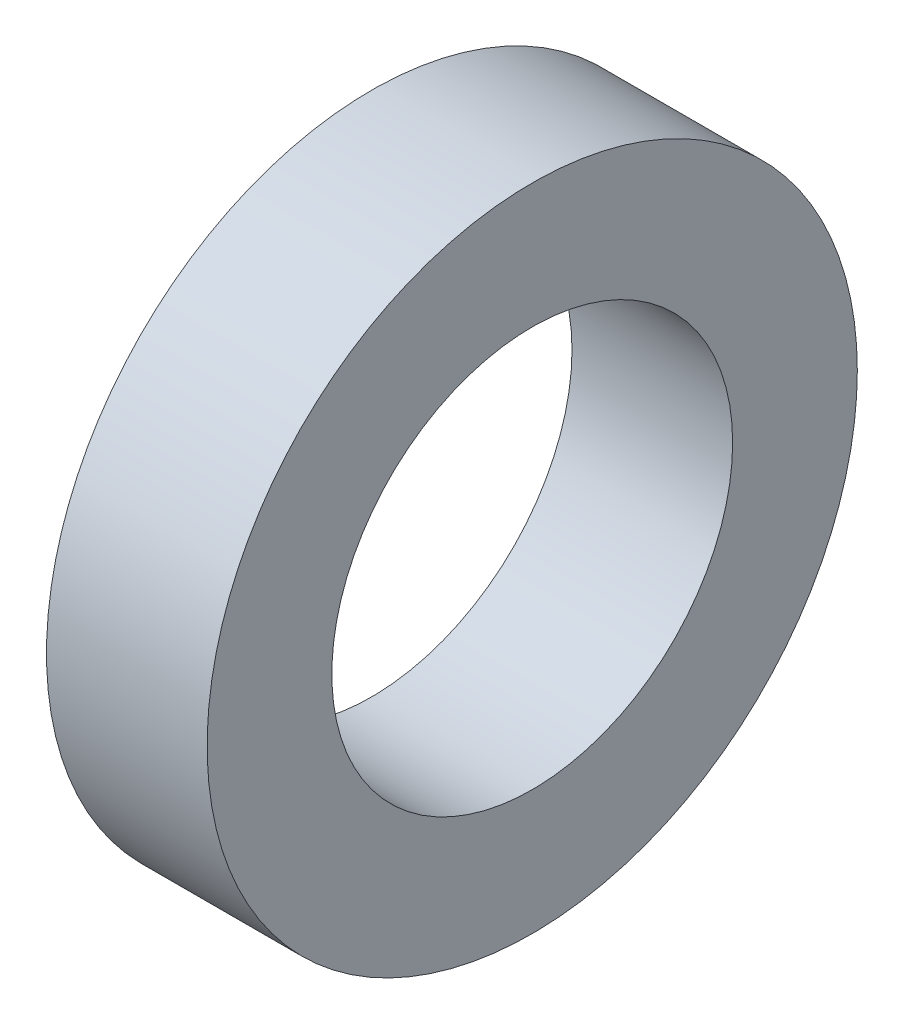
from build123d import *

# Parameters (mm, degrees)
SKETCH1_R           = 5.3975
SKETCH1_R_2         = 3.3274
BOSS_EXTRUDE1_DEPTH = 2.667


with BuildPart() as part:
    # Sketch1 → Boss-Extrude1 (new body)
    with BuildSketch(Plane(origin=(0, 0, 0), x_dir=(0, 0, -1), z_dir=(1, 0, 0))):
        Circle(SKETCH1_R)
        Circle(SKETCH1_R_2, mode=Mode.SUBTRACT)
    extrude(amount=BOSS_EXTRUDE1_DEPTH)


solid = part.part
